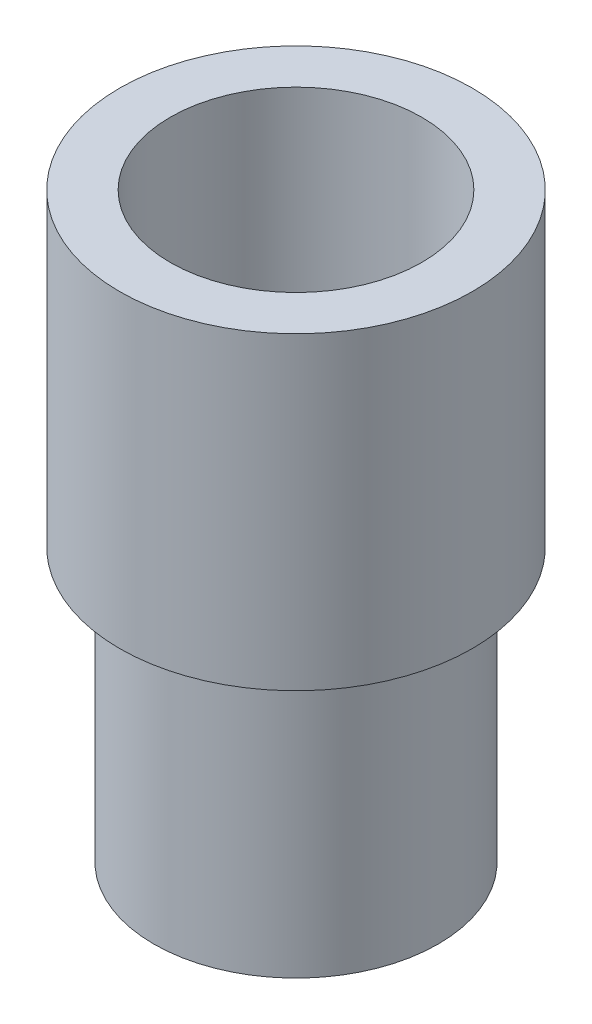
from build123d import *

# Parameters (mm, degrees)
SKETCH1_W   = 14.0462
SKETCH1_H   = 10
SKETCH1_W_2 = 1.8288
SKETCH1_H_2 = 30.48


with BuildPart() as part:
    # Sketch1 → Revolve1 (revolve)
    with BuildSketch(Plane.XY, mode=Mode.PRIVATE) as revolve1_sk:
        with Locations((7.0231, 35.48)):
            Rectangle(SKETCH1_W, SKETCH1_H)
        Polygon((14.0462, 40.48), (14.0462, 30.48), (15.875, 30.48), (19.685, 30.48), (19.685, 65), (14.0462, 65), align=None)
        with Locations((14.9606, 15.24)):
            Rectangle(SKETCH1_W_2, SKETCH1_H_2)
    revolve(revolve1_sk.sketch.rotate(Axis((0, 0, 0), (0, 1, 0)), 90), axis=Axis((0, 0, 0), (0, 1, 0)))


solid = part.part
